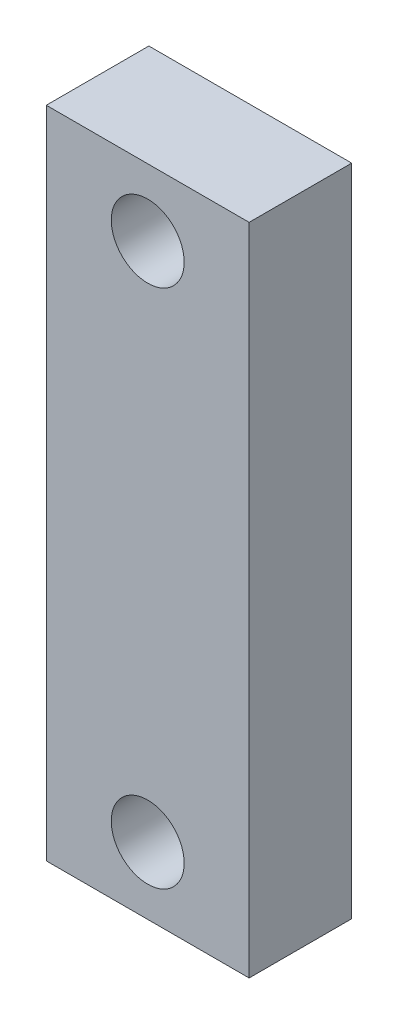
from build123d import *

# Parameters (mm, degrees)
SKETCH1_W           = 26.5
SKETCH1_H           = 85.5
BOSS_EXTRUDE1_DEPTH = 13.4
SKETCH2_R           = 4.7625
CUT_EXTRUDE1_DEPTH  = 13.4


with BuildPart() as part:
    # Sketch1 → Boss-Extrude1 (new body)
    with BuildSketch(Plane.XY):
        with Locations((13.25, 42.75)):
            Rectangle(SKETCH1_W, SKETCH1_H)
    extrude(amount=BOSS_EXTRUDE1_DEPTH)

    # Sketch2 → Cut-Extrude1 (cut)
    with BuildSketch(Plane.XY.offset(13.4)):
        with Locations((13.25, 8.75)):
            Circle(SKETCH2_R)
        with Locations((13.25, 76.75)):
            Circle(SKETCH2_R)
    extrude(amount=-CUT_EXTRUDE1_DEPTH, mode=Mode.SUBTRACT)


solid = part.part
